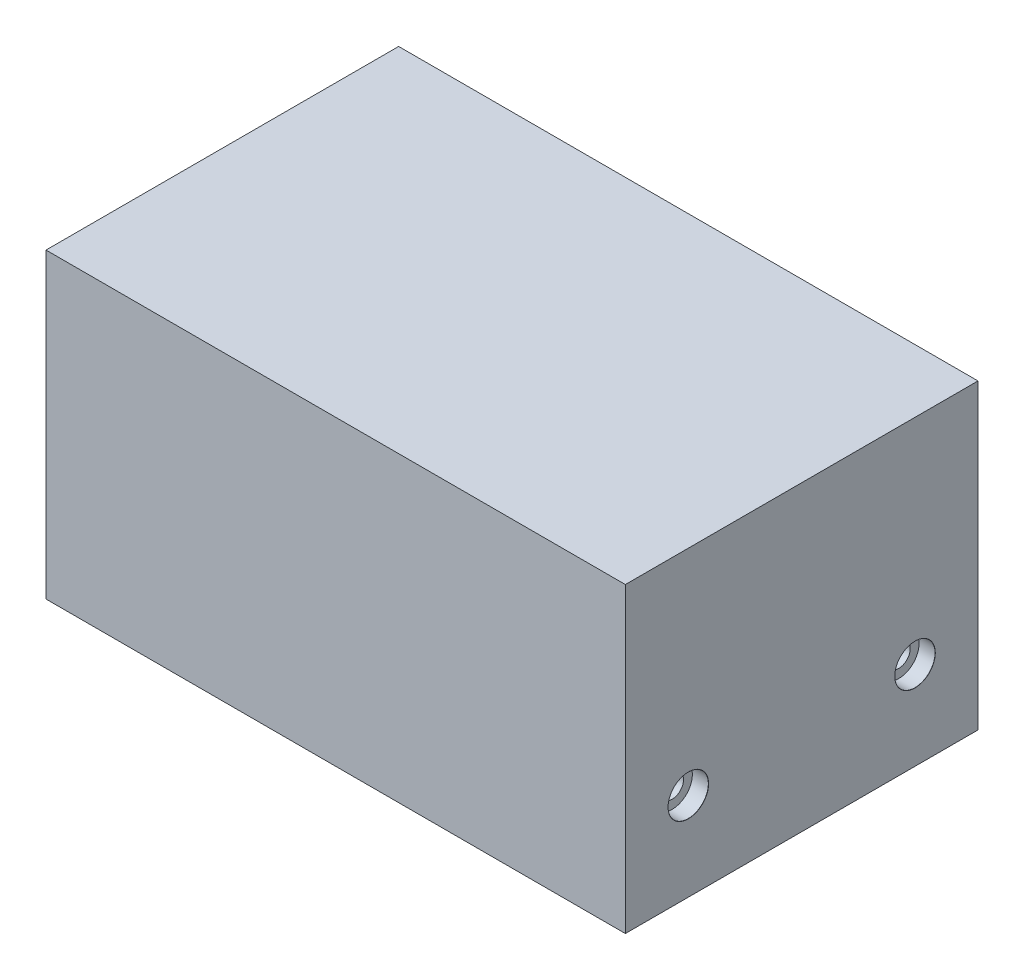
from build123d import *

# Parameters (mm, degrees)
CROQUIS1_W                                  = 115
CROQUIS1_H                                  = 70
SALIENTE_EXTRUIR1_DEPTH                     = 5
SALIENTE_EXTRUIR2_DEPTH                     = 55
CROQUIS3_W                                  = 60
CROQUIS3_H                                  = 5
SALIENTE_EXTRUIR3_DEPTH                     = 110
CROQUIS4_W                                  = 15
CROQUIS4_H                                  = 15
SALIENTE_EXTRUIR4_DEPTH                     = 5
REFRENTADO_PARA_TORNILLO_CON_CABEZA_2_COUNT = 2
REFRENTADO_PARA_TORNILLO_CON_CABEZA_2_PITCH = 45


with BuildPart() as part:
    # Croquis1 → Saliente-Extruir1 (new body)
    with BuildSketch(Plane(origin=(0, 0, 0), x_dir=(1, 0, 0), z_dir=(0, 1, 0))):
        with Locations((57.5, 35)):
            Rectangle(CROQUIS1_W, CROQUIS1_H)
    extrude(amount=SALIENTE_EXTRUIR1_DEPTH)

    # Croquis2 → Saliente-Extruir2 (add)
    with BuildSketch(Plane(origin=(0, 5, 0), x_dir=(1, 0, 0), z_dir=(0, 1, 0))):
        Polygon((0, 0), (115, 0), (115, 70), (0, 70), (0, 65), (110, 65), (110, 5), (0, 5), align=None)
    extrude(amount=SALIENTE_EXTRUIR2_DEPTH)

    # Croquis3 → Saliente-Extruir3 (add)
    with BuildSketch(Plane.ZY.offset(-110)):
        with Locations((-35, 57.5)):
            Rectangle(CROQUIS3_W, CROQUIS3_H)
    extrude(amount=SALIENTE_EXTRUIR3_DEPTH)

    # Croquis4 → Saliente-Extruir4 (add)
    with BuildSketch(Plane.ZY.offset(-110)):
        with Locations((-57.5, 17.5)):
            Rectangle(CROQUIS4_W, CROQUIS4_H)
        with Locations((-12.5, 17.5)):
            Rectangle(CROQUIS4_W, CROQUIS4_H)
    extrude(amount=SALIENTE_EXTRUIR4_DEPTH)

    # Croquis7 → Refrentado para tornillo con cabeza hueca de M41 (revolve, cut)
    with BuildSketch(Plane(origin=(115, 17.5, -12.5), x_dir=(0, 0, -1), z_dir=(0, 1, 0))):
        Polygon((0, 0), (0, 21.851936393), (2.25, 20.5), (2.25, 3.2), (4, 3.2), (4, 0.025), (4.025, 0), align=None)
    refrentado_para_tornillo_con_cabeza_huec = revolve(axis=Axis((121.35, 17.5, -12.5), (-1, 0, 0)), mode=Mode.SUBTRACT)

    # Refrentado para tornillo con cabeza  2: Refrentado para tornillo con cabeza hueca de M41 ×2
    with Locations(*[(0, 0, -i * REFRENTADO_PARA_TORNILLO_CON_CABEZA_2_PITCH) for i in range(1, REFRENTADO_PARA_TORNILLO_CON_CABEZA_2_COUNT)]):
        add(refrentado_para_tornillo_con_cabeza_huec, mode=Mode.SUBTRACT)


solid = part.part
